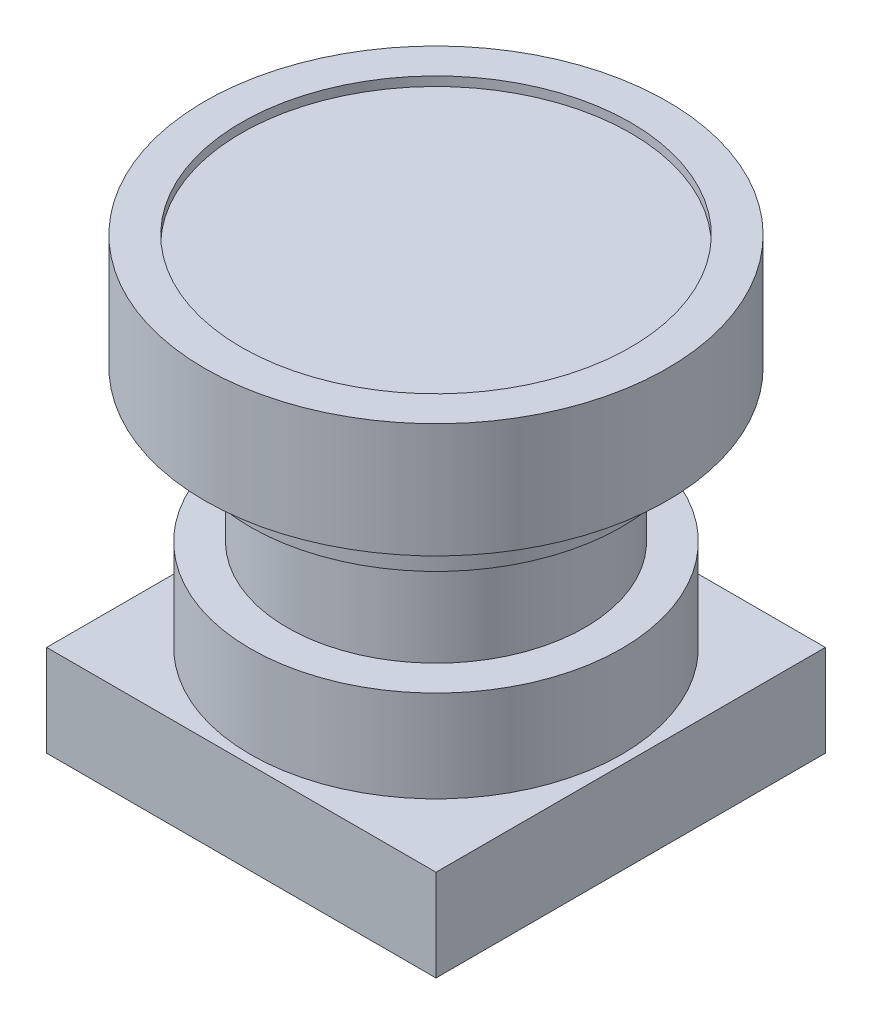
from build123d import *

# Parameters (mm, degrees)
SKETCH1_W           = 8.5
SKETCH1_H           = 8.5
BOSS_EXTRUDE1_DEPTH = 2
SKETCH2_R           = 4.05
SKETCH2_R_2         = 3.25
BOSS_EXTRUDE2_DEPTH = 2
SKETCH3_R           = 3.25
BOSS_EXTRUDE3_DEPTH = 4.3
SKETCH4_R           = 4.05
BOSS_EXTRUDE4_DEPTH = 1
SKETCH5_R           = 5.05
BOSS_EXTRUDE5_DEPTH = 2.5
SKETCH6_R           = 4.25
CUT_EXTRUDE1_DEPTH  = 0.2


with BuildPart() as part:
    # Sketch1 → Boss-Extrude1 (new body)
    with BuildSketch(Plane(origin=(0, 0, 0), x_dir=(1, 0, 0), z_dir=(0, 1, 0))):
        Rectangle(SKETCH1_W, SKETCH1_H)
    extrude(amount=BOSS_EXTRUDE1_DEPTH)

    # Sketch2 → Boss-Extrude2 (add)
    with BuildSketch(Plane(origin=(0, 2, 0), x_dir=(1, 0, 0), z_dir=(0, 1, 0))):
        with Locations(Location((0, 0, 0), (0, 0, 270))):
            Circle(SKETCH2_R)
        with Locations(Location((0, 0, 0), (0, 0, 270))):
            Circle(SKETCH2_R_2, mode=Mode.SUBTRACT)
    extrude(amount=BOSS_EXTRUDE2_DEPTH)

    # Sketch3 → Boss-Extrude3 (add)
    with BuildSketch(Plane(origin=(0, 2, 0), x_dir=(1, 0, 0), z_dir=(0, 1, 0))):
        with Locations(Location((0, 0, 0), (0, 0, 90))):
            Circle(SKETCH3_R)
    extrude(amount=BOSS_EXTRUDE3_DEPTH)

    # Sketch4 → Boss-Extrude4 (add)
    with BuildSketch(Plane(origin=(0, 6.3, 0), x_dir=(1, 0, 0), z_dir=(0, 1, 0))):
        with Locations(Location((0, 0, 0), (0, 0, 270))):
            Circle(SKETCH4_R)
    extrude(amount=BOSS_EXTRUDE4_DEPTH)

    # Sketch5 → Boss-Extrude5 (add)
    with BuildSketch(Plane(origin=(0, 7.3, 0), x_dir=(1, 0, 0), z_dir=(0, 1, 0))):
        with Locations(Location((0, 0, 0), (0, 0, 270))):
            Circle(SKETCH5_R)
    extrude(amount=BOSS_EXTRUDE5_DEPTH)

    # Sketch6 → Cut-Extrude1 (cut)
    with BuildSketch(Plane(origin=(0, 9.8, 0), x_dir=(1, 0, 0), z_dir=(0, 1, 0))):
        with Locations(Location((0, 0, 0), (0, 0, 270))):
            Circle(SKETCH6_R)
    extrude(amount=-CUT_EXTRUDE1_DEPTH, mode=Mode.SUBTRACT)


solid = part.part
